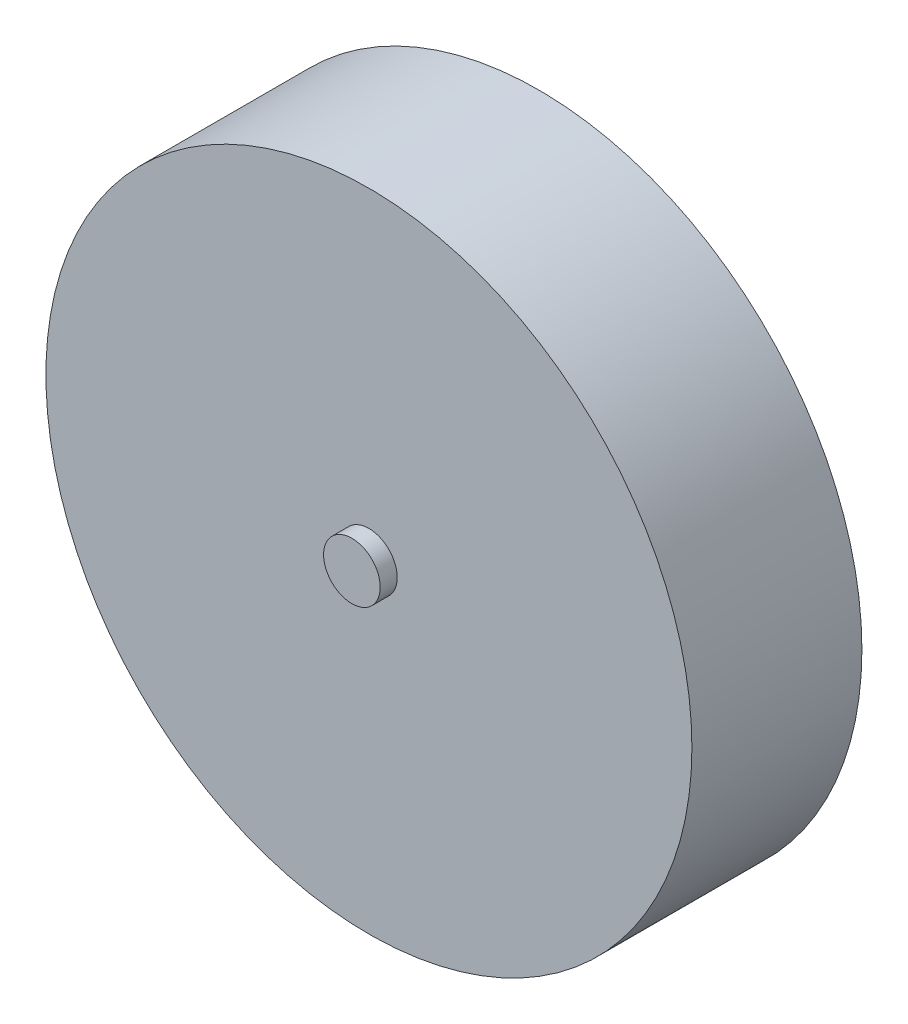
from build123d import *

# Parameters (mm, degrees)
ESQUISSE1_R        = 2.85
BOSS_EXTRU_2_DEPTH = 1.5
ESQUISSE3_R        = 0.25
BOSS_EXTRU_4_DEPTH = 0.15


with BuildPart() as part:
    # Esquisse1 → Boss.-Extru.2 (new body)
    with BuildSketch(Plane.XY):
        Circle(ESQUISSE1_R)
    extrude(amount=BOSS_EXTRU_2_DEPTH)

    # Esquisse3 → Boss.-Extru.4 (add)
    with BuildSketch(Plane.XY.offset(1.5)):
        Circle(ESQUISSE3_R)
    extrude(amount=BOSS_EXTRU_4_DEPTH)


solid = part.part
